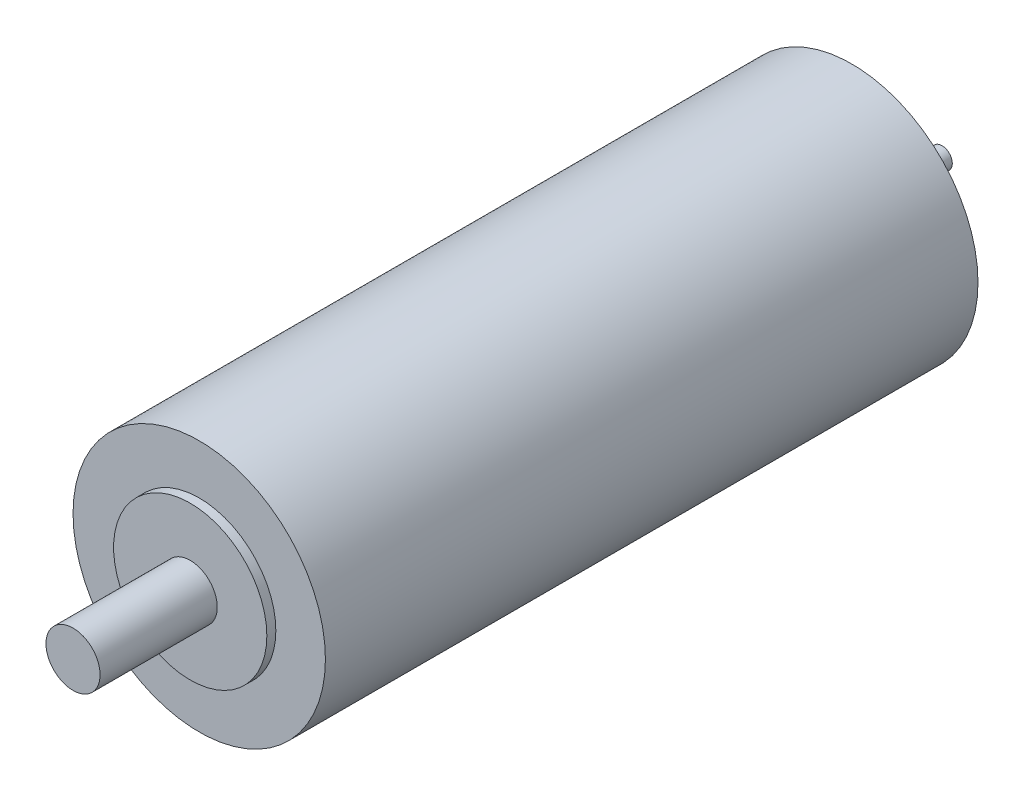
from build123d import *

# Parameters (mm, degrees)
SKETCH1_R           = 14
BOSS_EXTRUDE1_DEPTH = 36.2
SKETCH2_R           = 8.5
BOSS_EXTRUDE2_DEPTH = 1
SKETCH3_R           = 3
BOSS_EXTRUDE3_DEPTH = 13
SKETCH5_R           = 1.15
BOSS_EXTRUDE4_DEPTH = 10


with BuildPart() as part:
    # Sketch1 → Boss-Extrude1 (new, symmetric)
    with BuildSketch(Plane.XY):
        with Locations(Location((0, 0, 0), (0, 0, 180))):
            Circle(SKETCH1_R)
    extrude(amount=BOSS_EXTRUDE1_DEPTH, both=True)

    # Sketch2 → Boss-Extrude2 (add, symmetric)
    with BuildSketch(Plane.XY.offset(36.2)):
        Circle(SKETCH2_R)
    extrude(amount=BOSS_EXTRUDE2_DEPTH, both=True)

    # Sketch3 → Boss-Extrude3 (add)
    with BuildSketch(Plane.XY.offset(37.2)):
        with Locations(Location((0, 0, 0), (0, 0, 180))):
            Circle(SKETCH3_R)
    extrude(amount=BOSS_EXTRUDE3_DEPTH)

    # Sketch5 → Boss-Extrude4 (add)
    with BuildSketch(Plane(origin=(0, 0, -36.2), x_dir=(-1, 0, 0), z_dir=(0, 0, -1))):
        with Locations(Location((0, 0, 0), (0, 0, 180))):
            Circle(SKETCH5_R)
    extrude(amount=BOSS_EXTRUDE4_DEPTH)


solid = part.part
